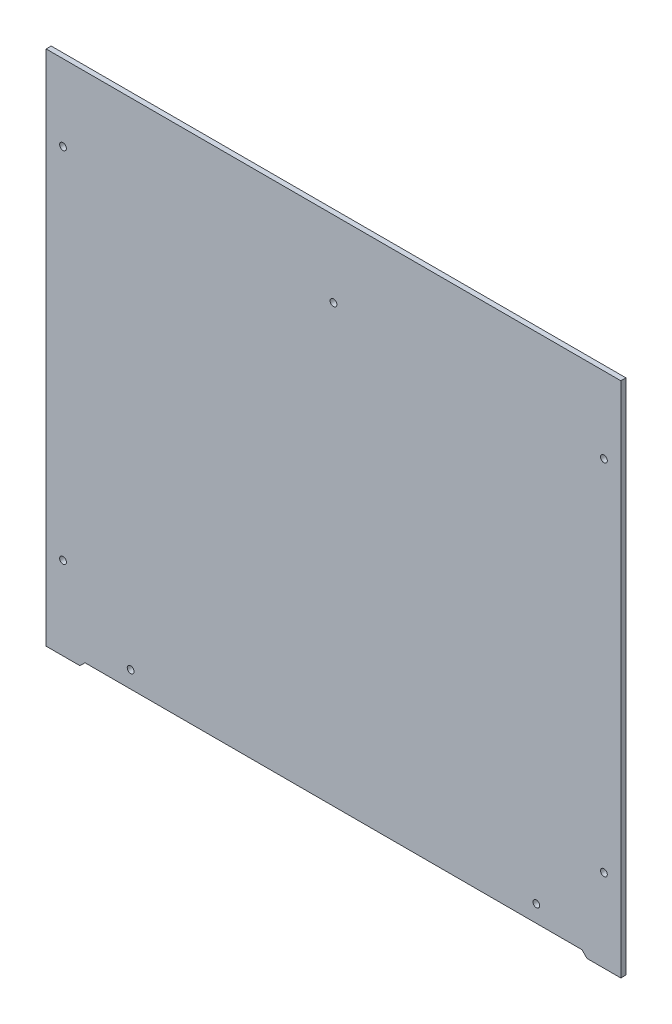
from build123d import *

# Parameters (mm, degrees)
SKETCH1_3_R         = 2
BOSS_EXTRUDE2_DEPTH = 3


with BuildPart() as part:
    # Sketch1<3> → Boss-Extrude2 (new body)
    with BuildSketch(Plane.XY):
        Polygon((170, 151.5), (-170, 151.5), (-170, -154.5), (-150, -154.5), (-147, -151.5), (147, -151.5), (150, -154.5), (170, -154.5), align=None)
        with Locations((-120, -141.5)):
            Circle(SKETCH1_3_R, mode=Mode.SUBTRACT)
        with Locations((-160, -105.5)):
            Circle(SKETCH1_3_R, mode=Mode.SUBTRACT)
        with Locations((120, -141.5)):
            Circle(SKETCH1_3_R, mode=Mode.SUBTRACT)
        with Locations((160, -105.5)):
            Circle(SKETCH1_3_R, mode=Mode.SUBTRACT)
        with Locations((-160, 106.5)):
            Circle(SKETCH1_3_R, mode=Mode.SUBTRACT)
        with Locations((0, 106.5)):
            Circle(SKETCH1_3_R, mode=Mode.SUBTRACT)
        with Locations((160, 106.5)):
            Circle(SKETCH1_3_R, mode=Mode.SUBTRACT)
    extrude(amount=BOSS_EXTRUDE2_DEPTH)


solid = part.part
